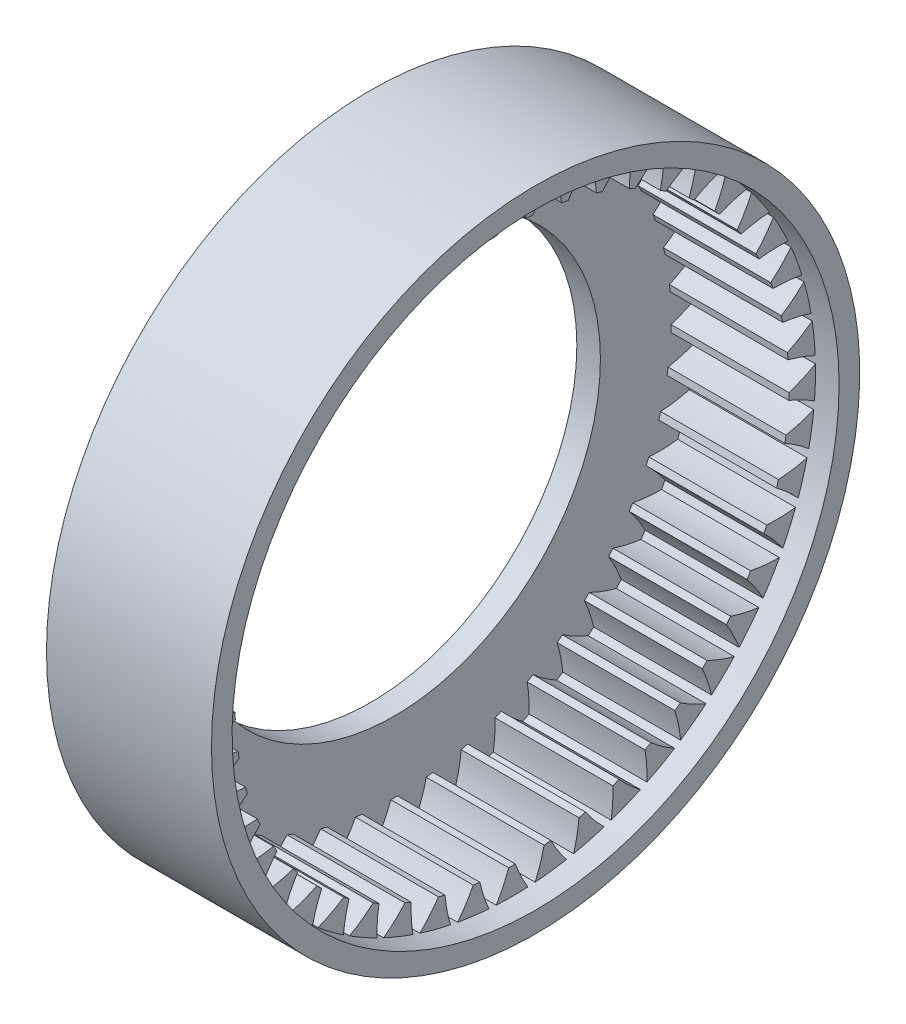
from build123d import *

# Parameters (mm, degrees)
BASPROSKE_W         = 12
BASPROSKE_H         = 4
TOOTHCUT_DEPTH      = 41.70012285
TEETHCUTS_COUNT     = 49
TEETHCUTS_ANGLE     = 352.653061224
SKETCH1_R           = 27.5
SKETCH1_R_2         = 17.5
BOSS_EXTRUDE1_DEPTH = 2
CUT_EXTRUDE1_START  = -2
SKETCH2_R           = 25.751
CUT_EXTRUDE1_DEPTH  = 2


with BuildPart() as part:
    # BasProSke → Base-Revolve (revolve)
    with BuildSketch(Plane(origin=(0, 0, 0), x_dir=(1, 0, 0), z_dir=(0, 1, 0)), mode=Mode.PRIVATE) as base_revolve_sk:
        with Locations((6, 25.5)):
            Rectangle(BASPROSKE_W, BASPROSKE_H)
    revolve(base_revolve_sk.sketch.rotate(Axis((-10, 0, 0), (1, 0, 0)), 180), axis=Axis((-10, 0, 0), (1, 0, 0)))

    # TooCutSke → ToothCut (cut, through all)
    with BuildSketch(Plane(origin=(0, 0, 0), x_dir=(0, 0, -1), z_dir=(1, 0, 0))):
        with BuildLine():
            ThreePointArc((1.228312028, 23.442442166), (0.827421591, 24.619136047), (0.309340174, 25.749141921))
            ThreePointArc((0.309340174, 25.749141921), (0, 25.751), (-0.309340174, 25.749141921))
            ThreePointArc((-0.309340174, 25.749141921), (-0.827421591, 24.619136047), (-1.228312028, 23.442442166))
            ThreePointArc((-1.228312028, 23.442442166), (0, 23.4746), (1.228312028, 23.442442166))
        make_face()
    toothcut = extrude(amount=TOOTHCUT_DEPTH, mode=Mode.SUBTRACT)

    # TeethCuts: ToothCut ×49 about axis
    teethcuts_axis = Axis((-10, 0, 0), (1, 0, 0))
    for i in range(1, TEETHCUTS_COUNT):
        add(toothcut.rotate(teethcuts_axis, i * TEETHCUTS_ANGLE / (TEETHCUTS_COUNT - 1)), mode=Mode.SUBTRACT)

    # Sketch1 → Boss-Extrude1 (add)
    with BuildSketch(Plane.ZY):
        Circle(SKETCH1_R)
        Circle(SKETCH1_R_2, mode=Mode.SUBTRACT)
    extrude(amount=BOSS_EXTRUDE1_DEPTH)

    # Sketch2 → Cut-Extrude1 (cut)
    with BuildSketch(Plane(origin=(12, 0, 0), x_dir=(0, 0, -1), z_dir=(1, 0, 0)).offset(CUT_EXTRUDE1_START)):
        with Locations(Location((0, 0, 0), (0, 0, 178.851561399))):
            Circle(SKETCH2_R)
    extrude(amount=CUT_EXTRUDE1_DEPTH, mode=Mode.SUBTRACT)


solid = part.part
